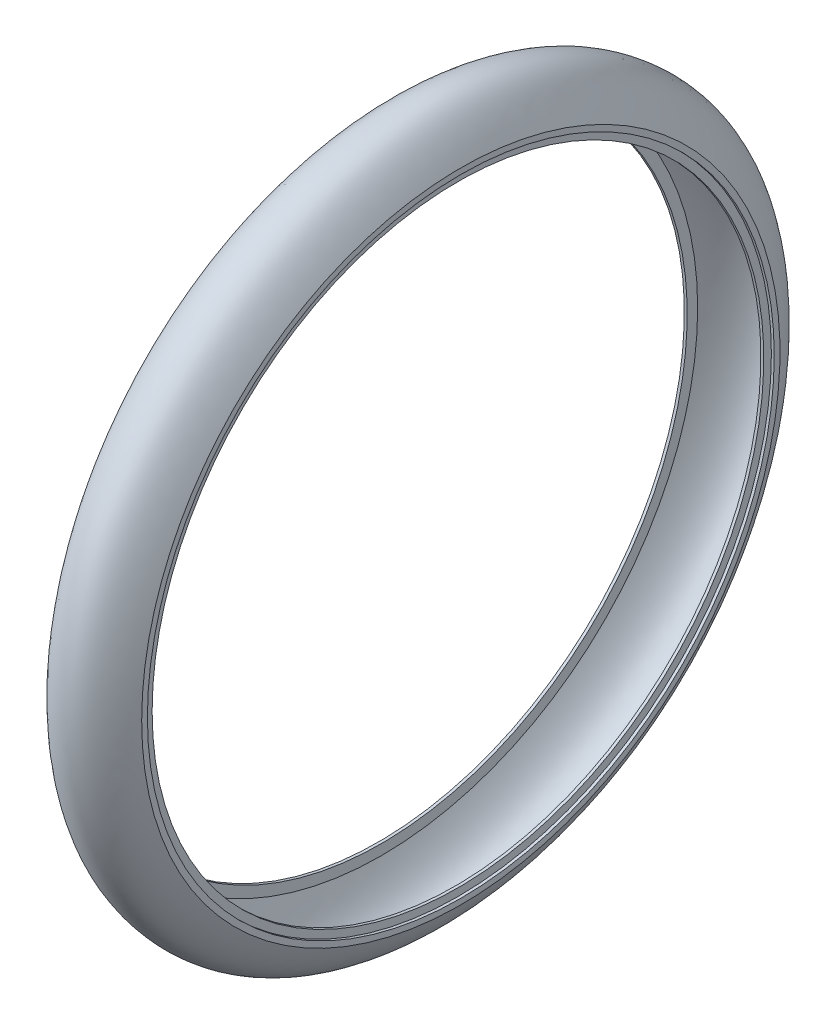
from build123d import *


with BuildPart() as part:
    # Sketch2 → Revolve2 (revolve)
    with BuildSketch(Plane.XY, mode=Mode.PRIVATE) as revolve2_sk:
        with BuildLine():
            Line((-27.755790387, 213.69), (-27.755790387, 219))
            Line((-27.755790387, 219), (-29.755790387, 219))
            Line((-29.755790387, 219), (-29.755790387, 223))
            add(Edge.make_bspline(
                [(-29.755790387, 223), (-20.376439122, 241.463411519), (-12.300961172, 249.216572011), (9.155653257, 250.708517907), (18.655125598, 243.693763863), (29.755790387, 223)],
                knots=[0, 0, 0, 0, 0.504857543, 0.604857543, 1, 1, 1, 1], degree=3))
            Line((29.755790387, 223), (29.755790387, 219))
            Line((29.755790387, 219), (27.755790387, 219))
            Line((27.755790387, 219), (27.755790387, 213.69))
            Line((27.755790387, 213.69), (25.755790387, 213.69))
            Line((25.755790387, 213.69), (25.755790387, 221))
            Line((25.755790387, 221), (27.755790387, 221))
            add(Edge.make_bspline(
                [(-27.755790387, 221), (0, 275), (27.755790387, 221)],
                knots=[0, 0, 0, 1, 1, 1], degree=2))
            Line((-27.755790387, 221), (-25.755790387, 221))
            Line((-25.755790387, 221), (-25.755790387, 213.69))
            Line((-25.755790387, 213.69), (-27.755790387, 213.69))
        make_face()
    revolve(revolve2_sk.sketch.rotate(Axis((-88.520461427, 0, 0), (1, 0, 0)), 90), axis=Axis((-88.520461427, 0, 0), (1, 0, 0)))


solid = part.part
